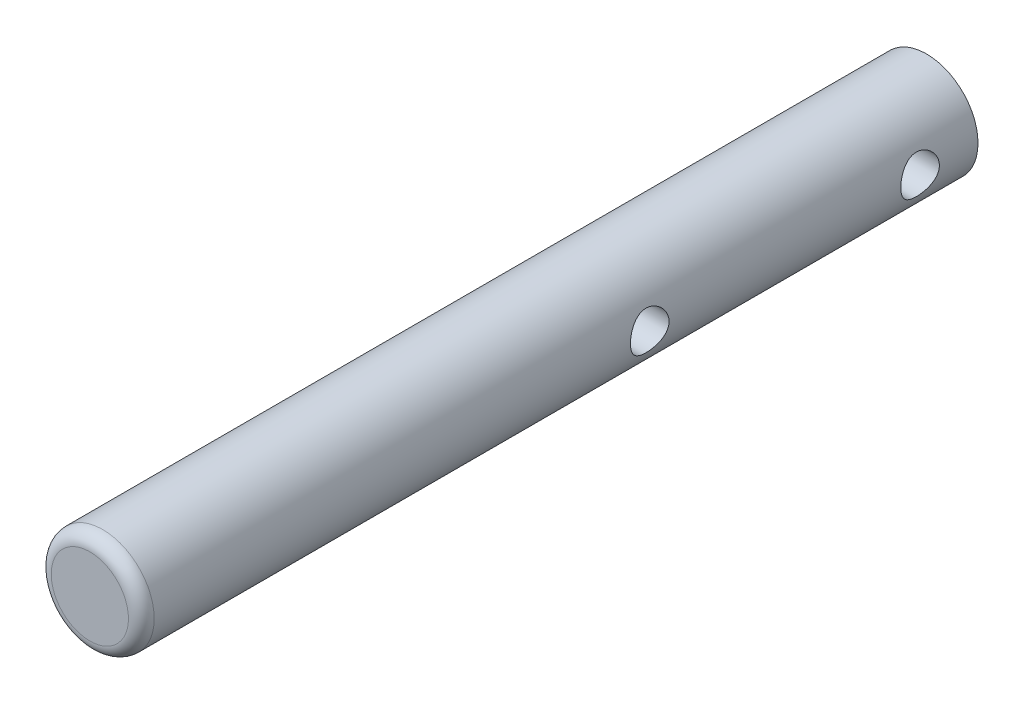
from build123d import *

# Parameters (mm, degrees)
ESQUISSE1_R             = 4
BOSS_EXTRU_1_DEPTH      = 65
ESQUISSE2_R             = 1.5
ENL_V_MAT_EXTRU_1_DEPTH = 5
CONG_1_R                = 1


with BuildPart() as part:
    # Esquisse1 → Boss.-Extru.1 (new body)
    with BuildSketch(Plane.XY):
        Circle(ESQUISSE1_R)
    extrude(amount=BOSS_EXTRU_1_DEPTH)

    # Esquisse2 → Enlèv. mat.-Extru.1 (cut, symmetric)
    with BuildSketch(Plane(origin=(0, 0, 0), x_dir=(0, 0, -1), z_dir=(1, 0, 0))):
        with Locations(Location((-25.5, 0, 0), (0, 0, 179.999999999))):
            Circle(ESQUISSE2_R)
        with Locations(Location((-4.5, 0, 0), (0, 0, 179.999999999))):
            Circle(ESQUISSE2_R)
    extrude(amount=ENL_V_MAT_EXTRU_1_DEPTH, both=True, mode=Mode.SUBTRACT)

    # Congé1
    cong_1_edges = [part.edges().sort_by_distance(p)[0] for p in [
        (-4, 0, 65),
    ]]
    fillet(cong_1_edges, radius=CONG_1_R)


solid = part.part
